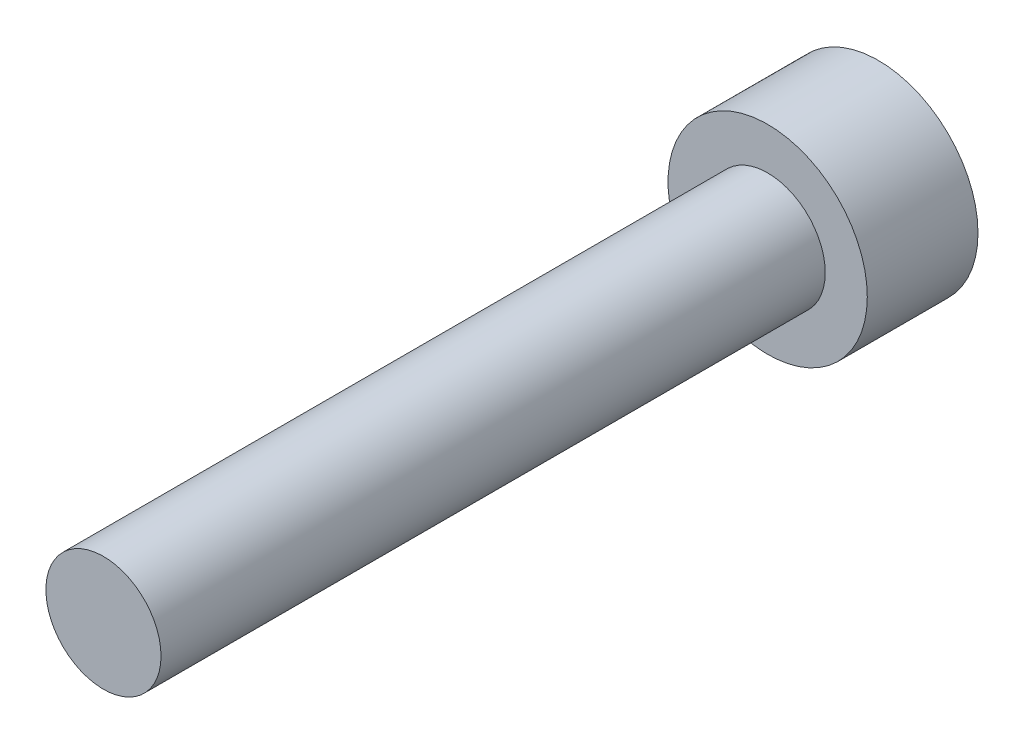
from build123d import *

# Parameters (mm, degrees)
SKETCH_1_R          = 2.25
EXTRUDE_1_DEPTH     = 2.5
SKETCH_2_R          = 1.3
EXTRUDE_2_DEPTH     = 15
CUT_EXTRUDE_1_DEPTH = 2


with BuildPart() as part:
    # ｽｹｯﾁ1 → ﾎﾞｽ - 押し出し1 (new body)
    with BuildSketch(Plane.XY):
        Circle(SKETCH_1_R)
    extrude(amount=EXTRUDE_1_DEPTH)

    # ｽｹｯﾁ2 → ﾎﾞｽ - 押し出し2 (add)
    with BuildSketch(Plane.XY.offset(2.5)):
        Circle(SKETCH_2_R)
    extrude(amount=EXTRUDE_2_DEPTH)

    # ｽｹｯﾁ3 → ｶｯﾄ - 押し出し1 (cut)
    with BuildSketch(Plane(origin=(0, 0, 0), x_dir=(-1, 0, 0), z_dir=(0, 0, -1))):
        Polygon((0.852242502, -0.763657679), (1.087468201, 0.356234818), (0.235225699, 1.119892496), (-0.852242502, 0.763657679), (-1.087468201, -0.356234818), (-0.235225699, -1.119892496), align=None)
    extrude(amount=-CUT_EXTRUDE_1_DEPTH, mode=Mode.SUBTRACT)


solid = part.part
